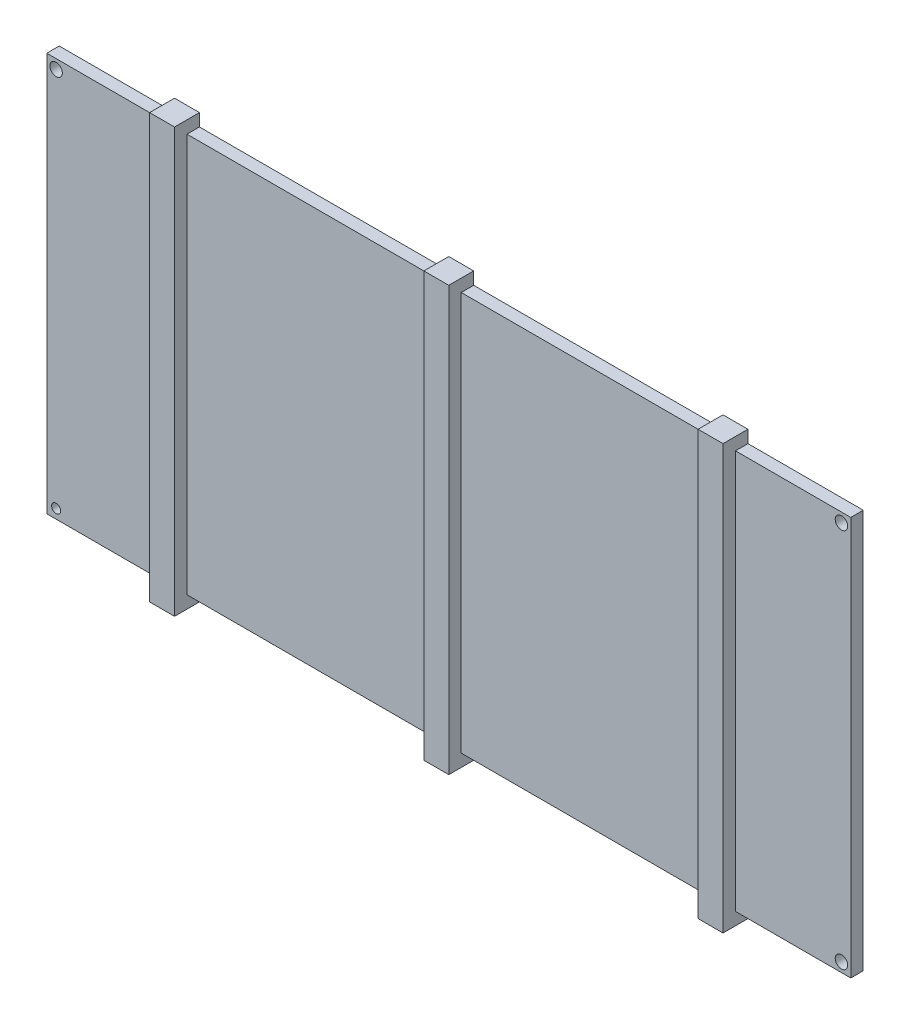
from build123d import *

# Parameters (mm, degrees)
EXTRUDE_1_DEPTH     = 2
SKETCH_2_W          = 4
SKETCH_2_H          = 68
EXTRUDE_2_DEPTH     = 2
SKETCH_3_R          = 1
SKETCH_3_R_2        = 0.725
CUT_EXTRUDE_1_DEPTH = 5


with BuildPart() as part:
    # Model → 凸台-拉伸1 (new body)
    with BuildSketch(Plane.XY):
        Polygon((257.555719115, 185.180286748), (276.055719115, 185.180286748), (276.055719115, 187.180286748), (280.055719115, 187.180286748), (280.055719115, 185.180286748), (320.055719115, 185.180286748), (320.055719115, 187.180286748), (324.055719115, 187.180286748), (324.055719115, 185.180286748), (364.055719115, 185.180286748), (364.055719115, 187.180286748), (368.055719115, 187.180286748), (368.055719115, 185.180286748), (386.555719115, 185.180286748), (386.555719115, 173.180286748), (386.555719115, 169.180286748), (386.555719115, 137.180286748), (386.555719115, 133.180286748), (386.555719115, 121.180286748), (368.055719115, 121.180286748), (368.055719115, 119.180286748), (364.055719115, 119.180286748), (364.055719115, 121.180286748), (332.555719115, 121.180286748), (324.055719115, 121.180286748), (324.055719115, 119.180286748), (322.055719115, 119.180286748), (320.055719115, 119.180286748), (320.055719115, 121.180286748), (311.555719115, 121.180286748), (280.055719115, 121.180286748), (280.055719115, 119.180286748), (276.055719115, 119.180286748), (276.055719115, 121.180286748), (257.555719115, 121.180286748), (257.555719115, 133.180286748), (257.555719115, 137.180286748), (257.555719115, 169.180286748), (257.555719115, 173.180286748), align=None)
    extrude(amount=EXTRUDE_1_DEPTH)

    # 草图2 → 凸台-拉伸2 (add)
    with BuildSketch(Plane.XY.offset(2)):
        with Locations((366.055719115, 153.180286748)):
            Rectangle(SKETCH_2_W, SKETCH_2_H)
        with Locations((322.055719115, 153.180286748)):
            Rectangle(SKETCH_2_W, SKETCH_2_H)
        with Locations((278.055719115, 153.180286748)):
            Rectangle(SKETCH_2_W, SKETCH_2_H)
    extrude(amount=EXTRUDE_2_DEPTH)

    # 草图3 → 切除-拉伸1 (cut)
    with BuildSketch(Plane.XY.offset(2)):
        with Locations((259.055719115, 183.680286748)):
            Circle(SKETCH_3_R)
        with Locations((385.055719115, 183.680286748)):
            Circle(SKETCH_3_R)
        with Locations((385.055719115, 122.680286748)):
            Circle(SKETCH_3_R)
        with Locations((259.055719115, 122.680286748)):
            Circle(SKETCH_3_R_2)
    extrude(amount=-CUT_EXTRUDE_1_DEPTH, mode=Mode.SUBTRACT)


solid = part.part
